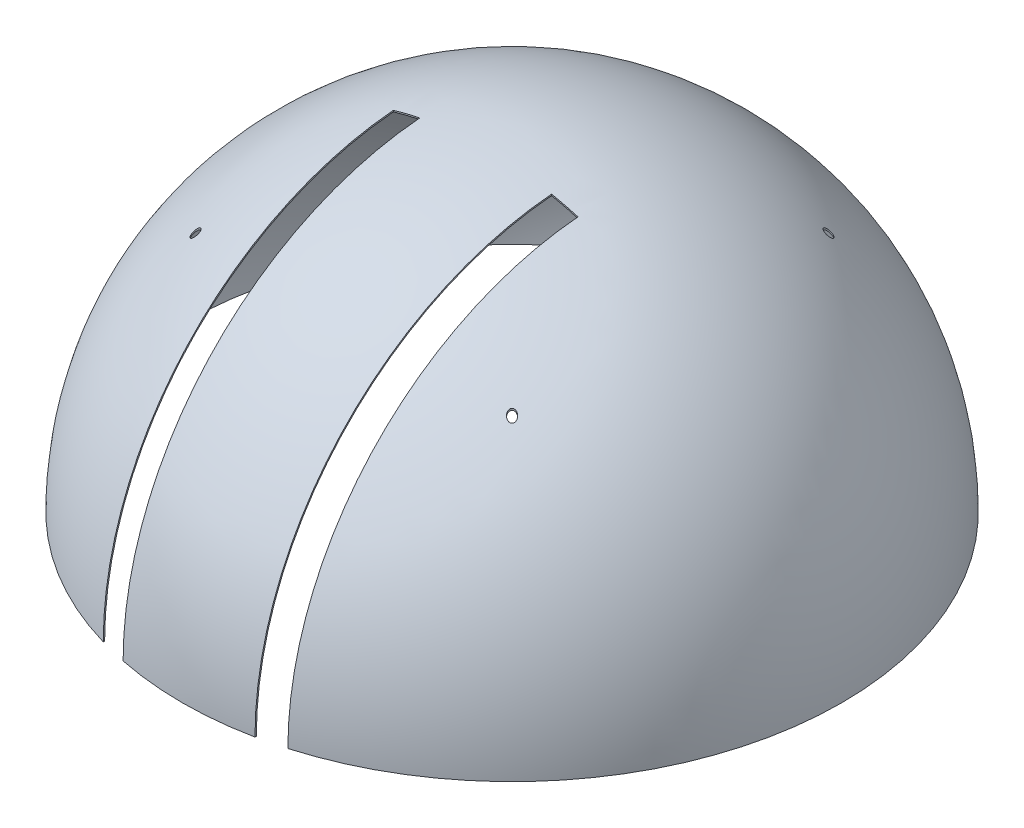
from build123d import *

# Parameters (mm, degrees)
REVOLVE_1_ANGLE          = 180
SHELL_1_T                = -1
CUT_EXTRUDE_1_DEPTH      = 434.012701892
CUT_EXTRUDE_1_DEPTH_BACK = 434.012701892
SKETCH_2_W               = 20
SKETCH_2_H               = 230
CUT_EXTRUDE_2_DEPTH      = 434.012701892
CUT_EXTRUDE_2_DEPTH_BACK = 434.012701892
SKETCH_3_R               = 3


with BuildPart() as part:
    # Эскиз1 → Повернуть1 (revolve)
    with BuildSketch(Plane(origin=(0, 0, 0), x_dir=(1, 0, 0), z_dir=(0, 1, 0))):
        with BuildLine():
            Line((-250, 0), (250, 0))
            ThreePointArc((250, 0), (0, 250), (-250, 0))
        make_face()
    revolve(axis=Axis((-250, 0, 0), (1, 0, 0)), revolution_arc=REVOLVE_1_ANGLE)

    # Оболочка1
    shell_1_openings = [part.faces().sort_by_distance(p)[0] for p in [
        (0, 0, 0),
    ]]
    offset(amount=SHELL_1_T, openings=shell_1_openings)

    # Эскиз2 → Вырез-Вытянуть1 (cut, two sides: drawn at the far end of the back side and taken through both)
    with BuildSketch(Plane(origin=(0, 0, 0), x_dir=(1, 0, 0), z_dir=(0, 1, 0)).offset(-CUT_EXTRUDE_1_DEPTH_BACK)):
        with Locations((-60, -135)):
            Rectangle(SKETCH_2_W, SKETCH_2_H)
        with Locations((60, -135)):
            Rectangle(SKETCH_2_W, SKETCH_2_H)
    extrude(amount=CUT_EXTRUDE_1_DEPTH + CUT_EXTRUDE_1_DEPTH_BACK, mode=Mode.SUBTRACT)

    # Эскиз3 → Вырез-Вытянуть2 (cut, two sides: drawn at the far end of the back side and taken through both)
    with BuildSketch(Plane(origin=(0, 0, 0), x_dir=(1, 0, 0), z_dir=(0, 1, 0)).offset(-CUT_EXTRUDE_2_DEPTH_BACK)):
        with Locations(Location((120, -120, 0), (0, 0, 315))):
            Circle(SKETCH_3_R)
        with Locations(Location((-120, -120, 0), (0, 0, 225))):
            Circle(SKETCH_3_R)
        with Locations(Location((-120, 120, 0), (0, 0, 135))):
            Circle(SKETCH_3_R)
        with Locations(Location((120, 120, 0), (0, 0, 45))):
            Circle(SKETCH_3_R)
    extrude(amount=CUT_EXTRUDE_2_DEPTH + CUT_EXTRUDE_2_DEPTH_BACK, mode=Mode.SUBTRACT)


solid = part.part
